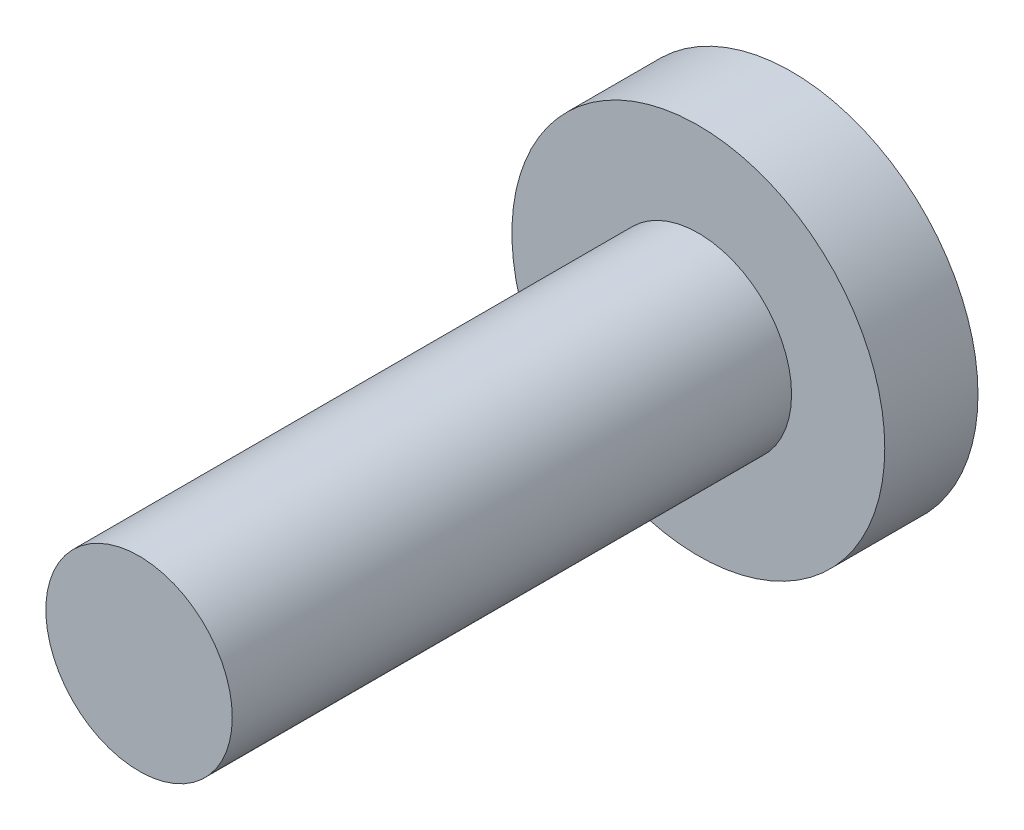
from build123d import *

# Parameters (mm, degrees)
ESBO_O1_R                = 10
RESSALTO_EXTRUS_O1_DEPTH = 5
ESBO_O2_R                = 5
RESSALTO_EXTRUS_O2_DEPTH = 30


with BuildPart() as part:
    # Esboço1 → Ressalto-extrusão1 (new body)
    with BuildSketch(Plane.XY):
        Circle(ESBO_O1_R)
    extrude(amount=RESSALTO_EXTRUS_O1_DEPTH)

    # Esboço2 → Ressalto-extrusão2 (add)
    with BuildSketch(Plane.XY.offset(5)):
        Circle(ESBO_O2_R)
    extrude(amount=RESSALTO_EXTRUS_O2_DEPTH)


solid = part.part
